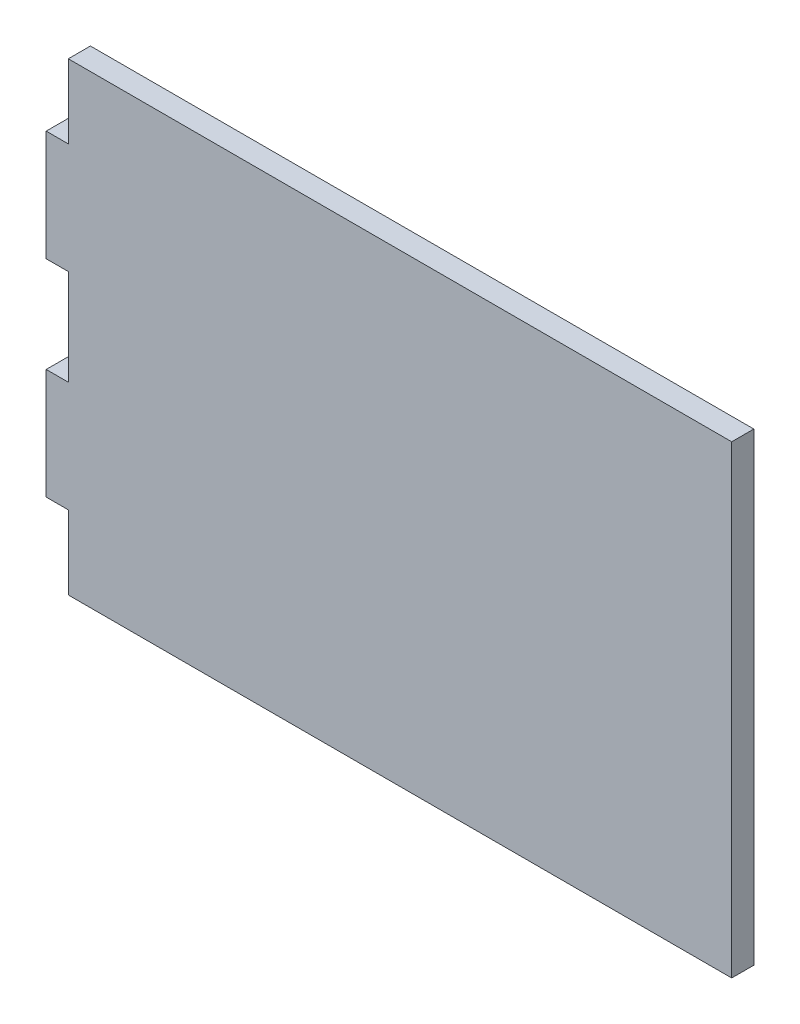
from build123d import *

# Parameters (mm, degrees)
SKETCH1_W           = 90
SKETCH1_H           = 63
SKETCH1_W_2         = 3
SKETCH1_H_2         = 15
BOSS_EXTRUDE1_DEPTH = 1.5


with BuildPart() as part:
    # Sketch1 → Boss-Extrude1 (new, symmetric)
    with BuildSketch(Plane.XY):
        Rectangle(SKETCH1_W, SKETCH1_H)
        with Locations((-46.5, 14)):
            Rectangle(SKETCH1_W_2, SKETCH1_H_2)
        with Locations((-46.5, -14)):
            Rectangle(SKETCH1_W_2, SKETCH1_H_2)
    extrude(amount=BOSS_EXTRUDE1_DEPTH, both=True)


solid = part.part
